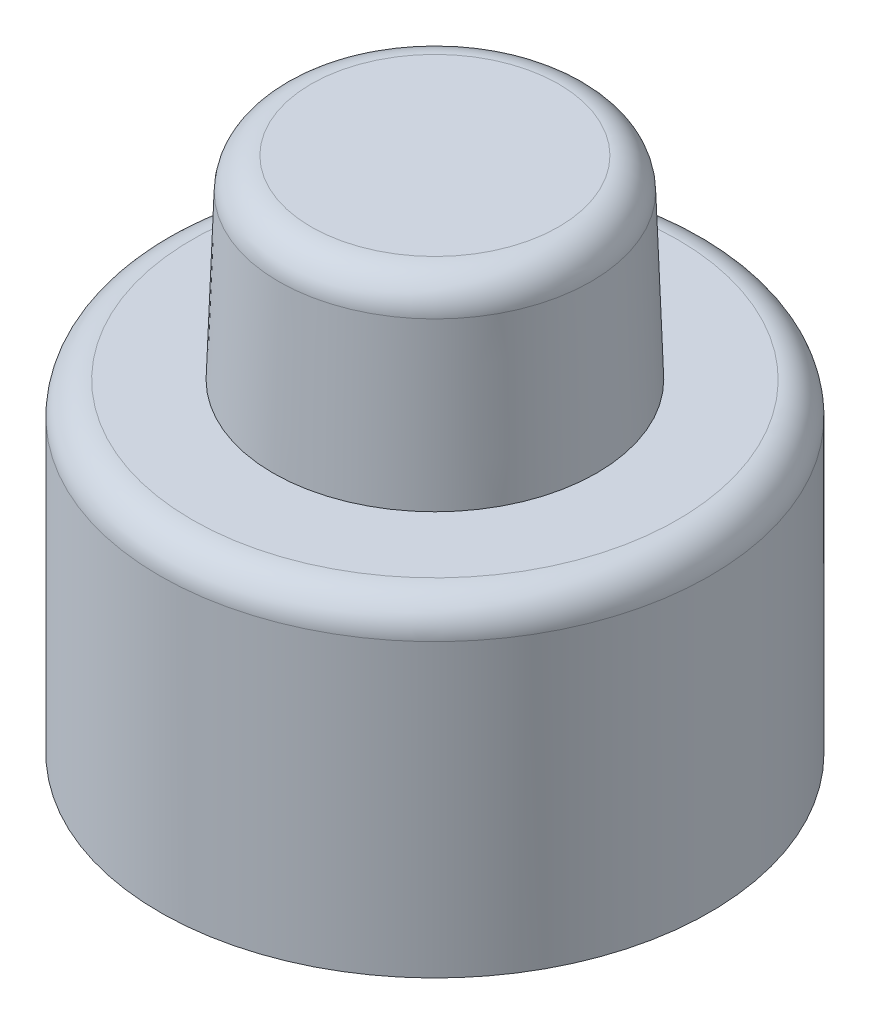
from build123d import *

# Parameters (mm, degrees)
SKETCH1_R           = 8.5
BOSS_EXTRUDE1_DEPTH = 6
FILLET2_R           = 1
SKETCH2_R           = 5
BOSS_EXTRUDE3_DEPTH = 6
BOSS_EXTRUDE3_TAPER = 2
FILLET4_R           = 1
BOSS_EXTRUDE4_START = 4
BOSS_EXTRUDE4_DEPTH = 4
CUT_EXTRUDE4_DEPTH  = 7


with BuildPart() as part:
    # Sketch1 → Boss-Extrude1 (new body)
    with BuildSketch(Plane(origin=(0, 0, 0), x_dir=(1, 0, 0), z_dir=(0, 1, 0))):
        with Locations(Location((-51.120170416, 0, 0), (0, 0, 270))):
            Circle(SKETCH1_R)
    extrude(amount=BOSS_EXTRUDE1_DEPTH)

    # Fillet2
    fillet2_edges = [part.edges().sort_by_distance(p)[0] for p in [
        (-51.120170416, 6, -8.5),
    ]]
    fillet(fillet2_edges, radius=FILLET2_R)

    # Sketch2 → Boss-Extrude3 (add)
    with BuildSketch(Plane(origin=(0, 6, 0), x_dir=(1, 0, 0), z_dir=(0, 1, 0))):
        with Locations((-51.120170416, 0)):
            Circle(SKETCH2_R)
    extrude(amount=BOSS_EXTRUDE3_DEPTH, taper=BOSS_EXTRUDE3_TAPER)

    # Fillet4
    fillet4_edges = [part.edges().sort_by_distance(p)[0] for p in [
        (-55.9106458, 12, 0),
    ]]
    fillet(fillet4_edges, radius=FILLET4_R)

    # Sketch3 → Boss-Extrude4 (add)
    with BuildSketch(Plane.XZ.offset(BOSS_EXTRUDE4_START)):
        with BuildLine():
            Line((-51.620170416, 0), (-59.620170416, 0))
            ThreePointArc((-59.620170416, 0), (-57.304828855, -5.830951895), (-51.620170416, -8.485281374))
            Line((-51.620170416, -8.485281374), (-51.620170416, 0))
        make_face()
        with BuildLine():
            ThreePointArc((-42.620170416, 0), (-51.120170416, 8.5), (-59.620170416, 0))
            Line((-59.620170416, 0), (-51.620170416, 0))
            Line((-51.620170416, 0), (-51.620170416, 1.514718626))
            Line((-51.620170416, 1.514718626), (-46.616547928, 1.514718626))
            Line((-46.616547928, 1.514718626), (-46.616547928, 0))
            Line((-46.616547928, 0), (-42.620170416, 0))
        make_face()
        with BuildLine():
            ThreePointArc((-46.616547928, -7.208840717), (-43.686100497, -4.121238215), (-42.620170416, 0))
            Line((-42.620170416, 0), (-46.616547928, 0))
            Line((-46.616547928, 0), (-46.616547928, -7.208840717))
        make_face()
    extrude(amount=-BOSS_EXTRUDE4_DEPTH)

    # Sketch6 → Cut-Extrude4 (cut)
    with BuildSketch(Plane.XZ.offset(4)):
        with BuildLine():
            ThreePointArc((-46.616547928, -7.208840717), (-49.019081783, -8.236226475), (-51.620170416, -8.485281374))
            Line((-51.620170416, -8.485281374), (-51.620170416, 1.514718626))
            Line((-51.620170416, 1.514718626), (-46.616547928, 1.514718626))
            Line((-46.616547928, 1.514718626), (-46.616547928, -7.208840717))
        make_face()
    extrude(amount=-CUT_EXTRUDE4_DEPTH, mode=Mode.SUBTRACT)


solid = part.part
